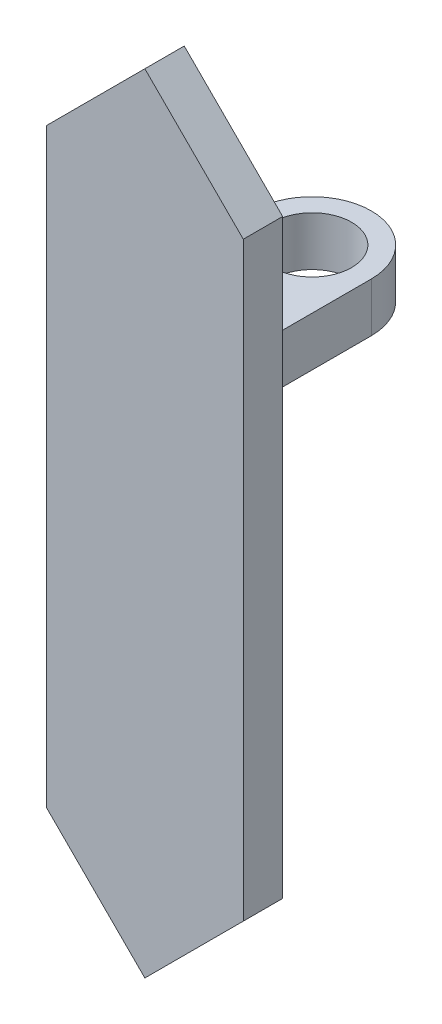
from build123d import *

# Parameters (mm, degrees)
EXTRUDE_1_DEPTH     = 4
SKETCH_2_W          = 12
SKETCH_2_H          = 5
EXTRUDE_2_DEPTH     = 20
SKETCH_6_R          = 4
CUT_EXTRUDE_5_DEPTH = 21


with BuildPart() as part:
    # 草图1 → 凸台-拉伸1 (new body)
    with BuildSketch(Plane.XY):
        Polygon((0.147281285, 10), (0.147281285, 70), (10.147281285, 80), (20.147281285, 70), (20.147281285, 10), (10.147281285, 0), align=None)
    extrude(amount=EXTRUDE_1_DEPTH)

    # 草图2 → 凸台-拉伸2 (add)
    with BuildSketch(Plane(origin=(0, 0, 0), x_dir=(-1, 0, 0), z_dir=(0, 0, -1))):
        with Locations((-10.147281285, 53.5)):
            Rectangle(SKETCH_2_W, SKETCH_2_H)
    extrude(amount=EXTRUDE_2_DEPTH)

    # 草图6 → 切除-拉伸5 (cut)
    with BuildSketch(Plane.XZ.offset(-51)):
        with Locations(Location((10.147281285, -13, 0), (0, 0, 270))):
            Circle(SKETCH_6_R)
        with BuildLine():
            Line((16.147281285, -20), (16.147281285, -13))
            ThreePointArc((16.147281285, -13), (10.147281285, -19), (4.147281285, -13))
            Line((4.147281285, -13), (4.147281285, -20))
            Line((4.147281285, -20), (16.147281285, -20))
        make_face()
    extrude(amount=-CUT_EXTRUDE_5_DEPTH, mode=Mode.SUBTRACT)


solid = part.part
